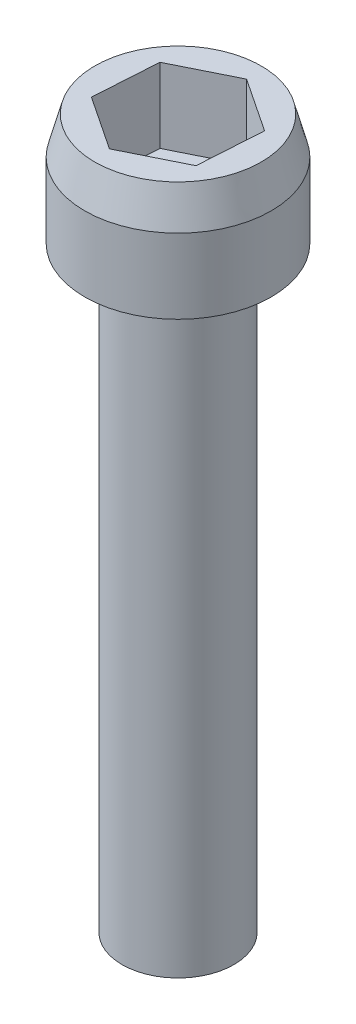
from build123d import *

# Parameters (mm, degrees)
SKICA1_R                 = 1.5
P_IDAT_VYSUNUT_M1_DEPTH  = 16
SKICA2_R                 = 2.5
P_IDAT_VYSUNUT_M2_DEPTH  = 3
ZKOSEN_1_SIZE            = 1
ZKOSEN_1_SIZE2           = 0.267949192
ODEBRAT_VYSUNUT_M1_DEPTH = 2


with BuildPart() as part:
    # Skica1 → Přidat vysunutím1 (new body)
    with BuildSketch(Plane(origin=(0, 0, 0), x_dir=(1, 0, 0), z_dir=(0, 1, 0))):
        with Locations(Location((0, 0, 0), (0, 0, 270))):
            Circle(SKICA1_R)
    extrude(amount=P_IDAT_VYSUNUT_M1_DEPTH)

    # Skica2 → Přidat vysunutím2 (add)
    with BuildSketch(Plane(origin=(0, 16, 0), x_dir=(1, 0, 0), z_dir=(0, 1, 0))):
        with Locations(Location((0, 0, 0), (0, 0, 270))):
            Circle(SKICA2_R)
    extrude(amount=P_IDAT_VYSUNUT_M2_DEPTH)

    # Zkosení1
    zkosen_1_edges = [part.edges().sort_by_distance(p)[0] for p in [
        (0, 19, -2.5),
    ]]
    zkosen_1_side = [part.faces().sort_by_distance(p)[0] for p in [
        (0, 17.5, -2.5),
    ]]
    chamfer(zkosen_1_edges, length=ZKOSEN_1_SIZE, length2=ZKOSEN_1_SIZE2, reference=zkosen_1_side[0])

    # Skica3 → Odebrat vysunutím1 (cut)
    with BuildSketch(Plane(origin=(0, 19, 0), x_dir=(1, 0, 0), z_dir=(0, 1, 0))):
        Polygon((-0.109437804, -1.728589994), (1.442283945, -0.959070916), (1.55172175, 0.769519078), (0.109437804, 1.728589994), (-1.442283945, 0.959070916), (-1.55172175, -0.769519078), align=None)
    extrude(amount=-ODEBRAT_VYSUNUT_M1_DEPTH, mode=Mode.SUBTRACT)


solid = part.part
